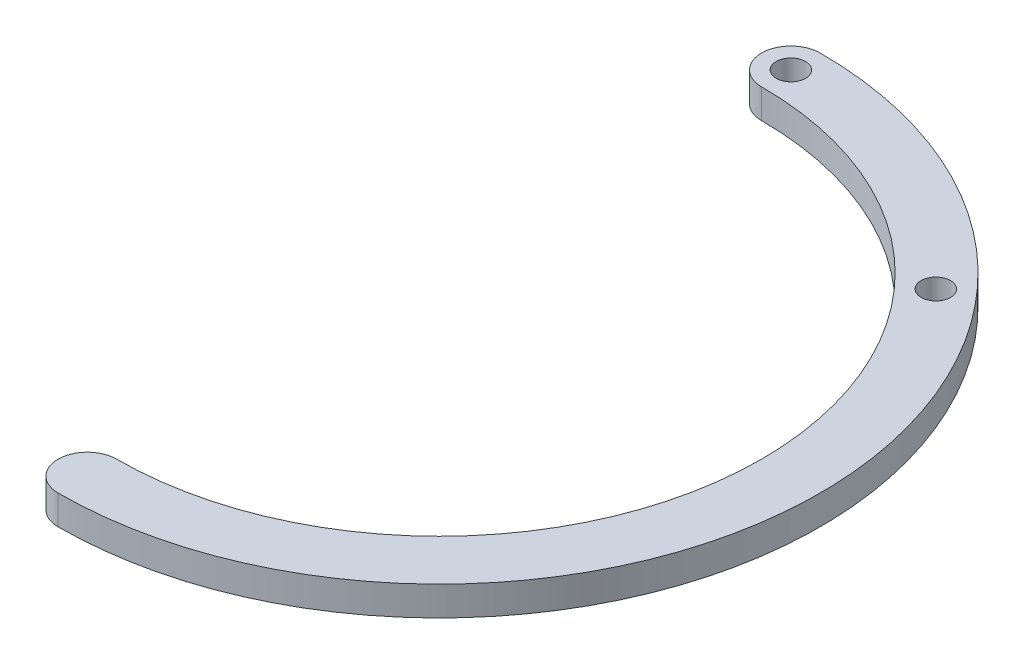
from build123d import *

# Parameters (mm, degrees)
SKETCH2_R           = 1.5875
BOSS_EXTRUDE1_DEPTH = 3.175


with BuildPart() as part:
    # Sketch2 → Boss-Extrude1 (new body)
    with BuildSketch(Plane(origin=(0, 0, 0), x_dir=(1, 0, 0), z_dir=(0, 1, 0))):
        with BuildLine():
            ThreePointArc((0, -41.275), (41.275, 0), (0, 41.275))
            ThreePointArc((0, 41.275), (-3.175, 38.1), (0, 34.925))
            ThreePointArc((0, 34.925), (34.925, 0), (0, -34.925))
            ThreePointArc((0, -34.925), (-3.175, -38.1), (0, -41.275))
        make_face()
        with Locations(Location((28.398063314, 25.4, 0), (0, 0, 270))):
            Circle(SKETCH2_R, mode=Mode.SUBTRACT)
        with Locations(Location((0, 38.1, 0), (0, 0, 270))):
            Circle(SKETCH2_R, mode=Mode.SUBTRACT)
    extrude(amount=BOSS_EXTRUDE1_DEPTH)


solid = part.part
